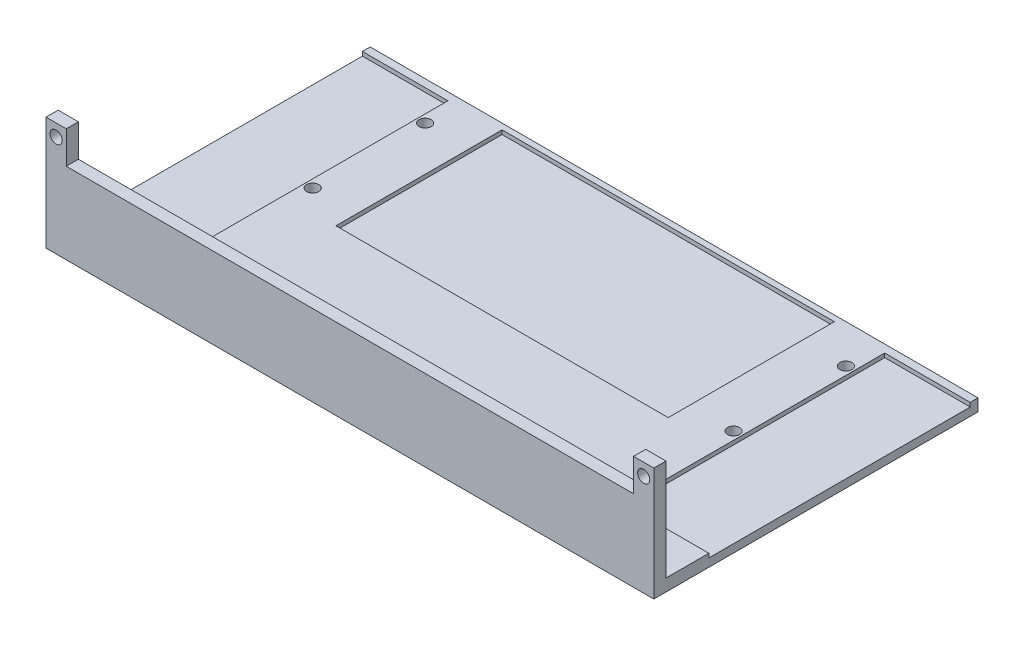
from build123d import *

# Parameters (mm, degrees)
BOSS_EXTRUDE2_DEPTH = 150
SKETCH4_W           = 21.1
SKETCH4_H           = 64.5
CUT_EXTRUDE1_DEPTH  = 1
SKETCH5_W           = 82
SKETCH5_H           = 41
CUT_EXTRUDE2_DEPTH  = 1
SKETCH6_W           = 140
SKETCH6_H           = 8
CUT_EXTRUDE3_DEPTH  = 3
SKETCH7_R           = 1.5
CUT_EXTRUDE4_DEPTH  = 3
SKETCH8_R           = 1.5
CUT_EXTRUDE5_DEPTH  = 3


with BuildPart() as part:
    # Sketch1 → Boss-Extrude2 (new body)
    with BuildSketch(Plane(origin=(0, 0, 0), x_dir=(0, 0, -1), z_dir=(1, 0, 0))):
        Polygon((-62.755935242, 0), (-62.755935242, 28), (-59.755935242, 28), (-59.755935242, 3), (17.244064758, 3), (17.244064758, 0), align=None)
    extrude(amount=-BOSS_EXTRUDE2_DEPTH)

    # Sketch4 → Cut-Extrude1 (cut)
    with BuildSketch(Plane(origin=(0, 3, 0), x_dir=(1, 0, 0), z_dir=(0, 1, 0))):
        with Locations((-139.45, -16.927076403)):
            Rectangle(SKETCH4_W, SKETCH4_H)
        with Locations((-10.55, -16.927076403)):
            Rectangle(SKETCH4_W, SKETCH4_H)
    extrude(amount=-CUT_EXTRUDE1_DEPTH, mode=Mode.SUBTRACT)

    # Sketch5 → Cut-Extrude2 (cut)
    with BuildSketch(Plane(origin=(0, 3, 0), x_dir=(1, 0, 0), z_dir=(0, 1, 0))):
        with Locations((-75, -4.705935242)):
            Rectangle(SKETCH5_W, SKETCH5_H)
    extrude(amount=-CUT_EXTRUDE2_DEPTH, mode=Mode.SUBTRACT)

    # Sketch6 → Cut-Extrude3 (cut)
    with BuildSketch(Plane.XY.offset(62.755935242)):
        with Locations((-75, 24)):
            Rectangle(SKETCH6_W, SKETCH6_H)
    extrude(amount=-CUT_EXTRUDE3_DEPTH, mode=Mode.SUBTRACT)

    # Sketch7 → Cut-Extrude4 (cut)
    with BuildSketch(Plane.XY.offset(62.755935242)):
        with Locations((-2.5, 25)):
            Circle(SKETCH7_R)
        with Locations((-147.5, 25)):
            Circle(SKETCH7_R)
    extrude(amount=-CUT_EXTRUDE4_DEPTH, mode=Mode.SUBTRACT)

    # Sketch8 → Cut-Extrude5 (cut)
    with BuildSketch(Plane(origin=(0, 3, 0), x_dir=(1, 0, 0), z_dir=(0, 1, 0))):
        with Locations(Location((-23.1, -47.755935242, 0), (0, 0, 270))):
            Circle(SKETCH8_R)
        with Locations(Location((-23.1, -20.005935242, 0), (0, 0, 270))):
            Circle(SKETCH8_R)
        with Locations(Location((-23.1, 7.744064758, 0), (0, 0, 270))):
            Circle(SKETCH8_R)
        with Locations(Location((-126.934112686, -47.755935242, 0), (0, 0, 270))):
            Circle(SKETCH8_R)
        with Locations(Location((-126.934112686, -20.005935242, 0), (0, 0, 270))):
            Circle(SKETCH8_R)
        with Locations(Location((-126.934112686, 7.744064758, 0), (0, 0, 270))):
            Circle(SKETCH8_R)
    extrude(amount=-CUT_EXTRUDE5_DEPTH, mode=Mode.SUBTRACT)


solid = part.part
